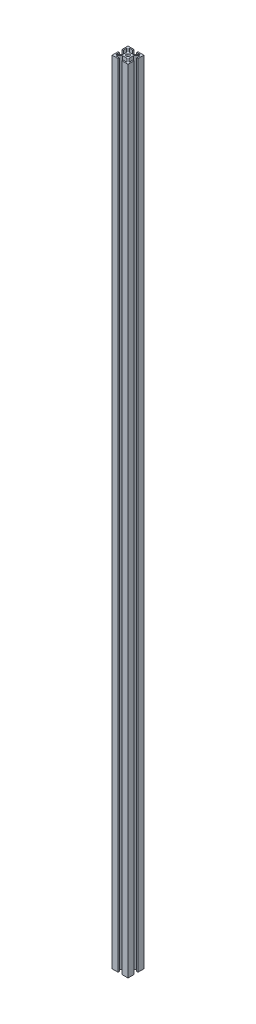
from build123d import *

# Parameters (mm, degrees)
SKETCH1_R           = 2.15
BOSS_EXTRUDE1_DEPTH = 1000


with BuildPart() as part:
    # Sketch1 → Boss-Extrude1 (new body)
    with BuildSketch(Plane(origin=(0, 0, 0), x_dir=(1, 0, 0), z_dir=(0, 1, 0))):
        Polygon((-10, 10), (-2.5, 10), (-2.5, 8.499999999), (-6.75, 8.499999999), (-6.75, 7.77515127), (-2.97484873, 4), (2.97484873, 4), (6.75, 7.77515127), (6.75, 8.499999999), (2.5, 8.499999999), (2.5, 10), (10, 10), (10, 2.5), (8.5, 2.5), (8.5, 6.75), (7.846169074, 6.75), (4, 2.903830926), (4, -2.903830926), (7.846169074, -6.75), (8.5, -6.75), (8.5, -2.5), (10, -2.5), (10, -10), (2.5, -10), (2.5, -8.499999999), (6.75, -8.499999999), (6.75, -7.77515127), (2.97484873, -4), (-2.97484873, -4), (-6.75, -7.77515127), (-6.75, -8.499999999), (-2.5, -8.499999999), (-2.5, -10), (-10, -10), (-10, -2.5), (-8.5, -2.5), (-8.5, -6.75), (-7.846169074, -6.75), (-4, -2.903830926), (-4, 2.903830926), (-7.846169074, 6.75), (-8.5, 6.75), (-8.5, 2.5), (-10, 2.5), align=None)
        with Locations(Location((0, 0, 0), (0, 0, 270))):
            Circle(SKETCH1_R, mode=Mode.SUBTRACT)
    extrude(amount=BOSS_EXTRUDE1_DEPTH)


solid = part.part
